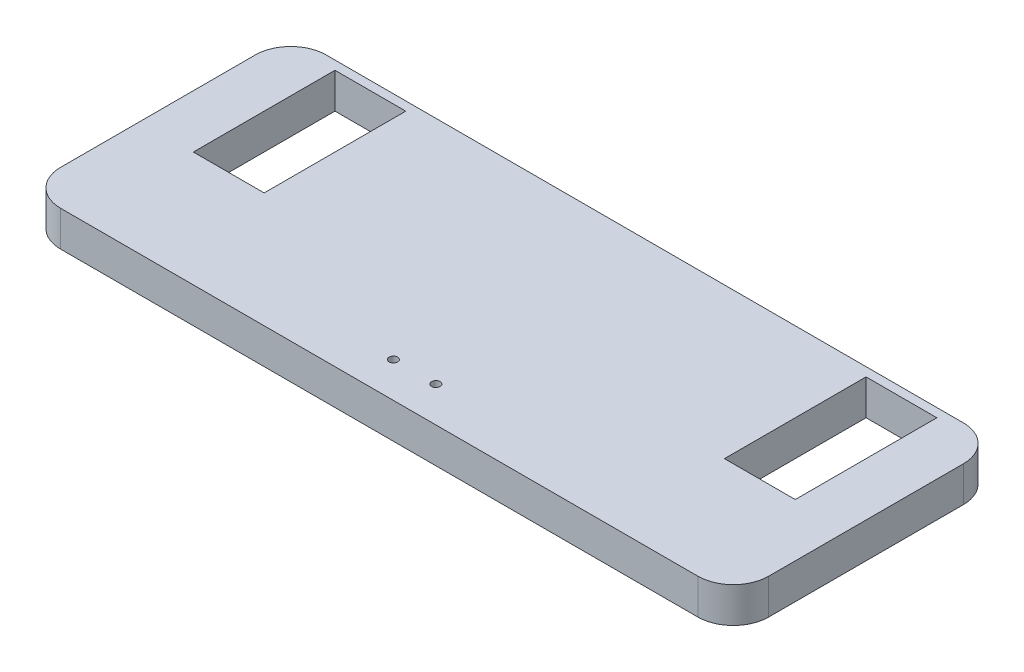
from build123d import *

# Parameters (mm, degrees)
ESQUISSE1_W             = 200
ESQUISSE1_H             = 75
BOSS_EXTRU_1_DEPTH      = 10
CONG_1_R                = 10
ESQUISSE2_W             = 20
ESQUISSE2_H             = 40
ENL_V_MAT_EXTRU_1_DEPTH = 10
ESQUISSE3_W             = 20
ESQUISSE3_H             = 10
ENL_V_MAT_EXTRU_2_DEPTH = 1
D_GAGEMENT_M21_D        = 2.4


with BuildPart() as part:
    # Esquisse1 → Boss.-Extru.1 (new body)
    with BuildSketch(Plane(origin=(0, 0, 0), x_dir=(1, 0, 0), z_dir=(0, 1, 0))):
        with Locations((100, 37.5)):
            Rectangle(ESQUISSE1_W, ESQUISSE1_H)
    extrude(amount=BOSS_EXTRU_1_DEPTH)

    # Congé1
    cong_1_edges = [part.edges().sort_by_distance(p)[0] for p in [
        (0, 5, 0),
        (200, 5, 0),
        (200, 5, -75),
        (0, 5, -75),
    ]]
    fillet(cong_1_edges, radius=CONG_1_R)

    # Esquisse2 → Enlèv. mat.-Extru.1 (cut)
    with BuildSketch(Plane(origin=(0, 10, 0), x_dir=(1, 0, 0), z_dir=(0, 1, 0))):
        with Locations((25, 52.5)):
            Rectangle(ESQUISSE2_W, ESQUISSE2_H)
        with Locations((175, 52.5)):
            Rectangle(ESQUISSE2_W, ESQUISSE2_H)
    extrude(amount=-ENL_V_MAT_EXTRU_1_DEPTH, mode=Mode.SUBTRACT)

    # Esquisse3 → Enlèv. mat.-Extru.2 (cut)
    with BuildSketch(Plane.XZ):
        with Locations((100, -10)):
            Rectangle(ESQUISSE3_W, ESQUISSE3_H)
    extrude(amount=-ENL_V_MAT_EXTRU_2_DEPTH, mode=Mode.SUBTRACT)

    # Dégagement M21 (through all)
    with Locations(Plane(origin=(0, 1, 0), x_dir=(-1, 0, 0), z_dir=(0, -1, 0))):
        with Locations((-106, 10), (-94, 10)):
            Hole(D_GAGEMENT_M21_D / 2)


solid = part.part
